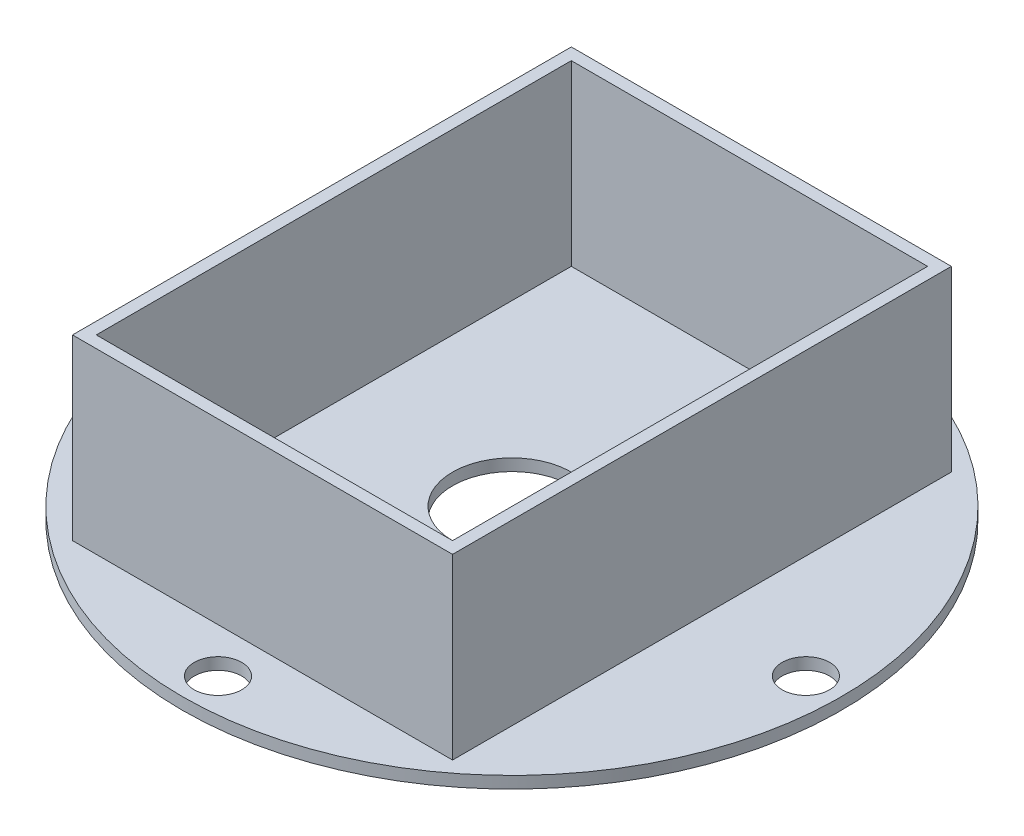
from build123d import *

# Parameters (mm, degrees)
SKETCH1_R           = 55.5
SKETCH1_R_2         = 4
BOSS_EXTRUDE4_DEPTH = 2
SKETCH6_W           = 64
SKETCH6_H           = 84
SKETCH6_W_2         = 60
SKETCH6_H_2         = 80
BOSS_EXTRUDE5_DEPTH = 30
SKETCH7_R           = 10
CUT_EXTRUDE2_DEPTH  = 30


with BuildPart() as part:
    # Sketch1 → Boss-Extrude4 (new body)
    with BuildSketch(Plane(origin=(0, 0, 0), x_dir=(1, 0, 0), z_dir=(0, 1, 0))):
        with Locations(Location((0, 0, 0), (0, 0, 270))):
            Circle(SKETCH1_R)
        with Locations(Location((0, 49.5, 0), (0, 0, 270))):
            Circle(SKETCH1_R_2, mode=Mode.SUBTRACT)
        with Locations(Location((49.5, 0, 0), (0, 0, 270))):
            Circle(SKETCH1_R_2, mode=Mode.SUBTRACT)
        with Locations(Location((-49.5, 0, 0), (0, 0, 270))):
            Circle(SKETCH1_R_2, mode=Mode.SUBTRACT)
        with Locations(Location((0, -49.5, 0), (0, 0, 270))):
            Circle(SKETCH1_R_2, mode=Mode.SUBTRACT)
    extrude(amount=BOSS_EXTRUDE4_DEPTH)

    # Sketch6 → Boss-Extrude5 (add)
    with BuildSketch(Plane(origin=(0, 2, 0), x_dir=(1, 0, 0), z_dir=(0, 1, 0))):
        Rectangle(SKETCH6_W, SKETCH6_H)
        Rectangle(SKETCH6_W_2, SKETCH6_H_2, mode=Mode.SUBTRACT)
    extrude(amount=BOSS_EXTRUDE5_DEPTH)

    # Sketch7 → Cut-Extrude2 (cut)
    with BuildSketch(Plane(origin=(0, 2, 0), x_dir=(1, 0, 0), z_dir=(0, 1, 0))):
        with Locations(Location((0, 0, 0), (0, 0, 270))):
            Circle(SKETCH7_R)
    extrude(amount=-CUT_EXTRUDE2_DEPTH, mode=Mode.SUBTRACT)


solid = part.part
